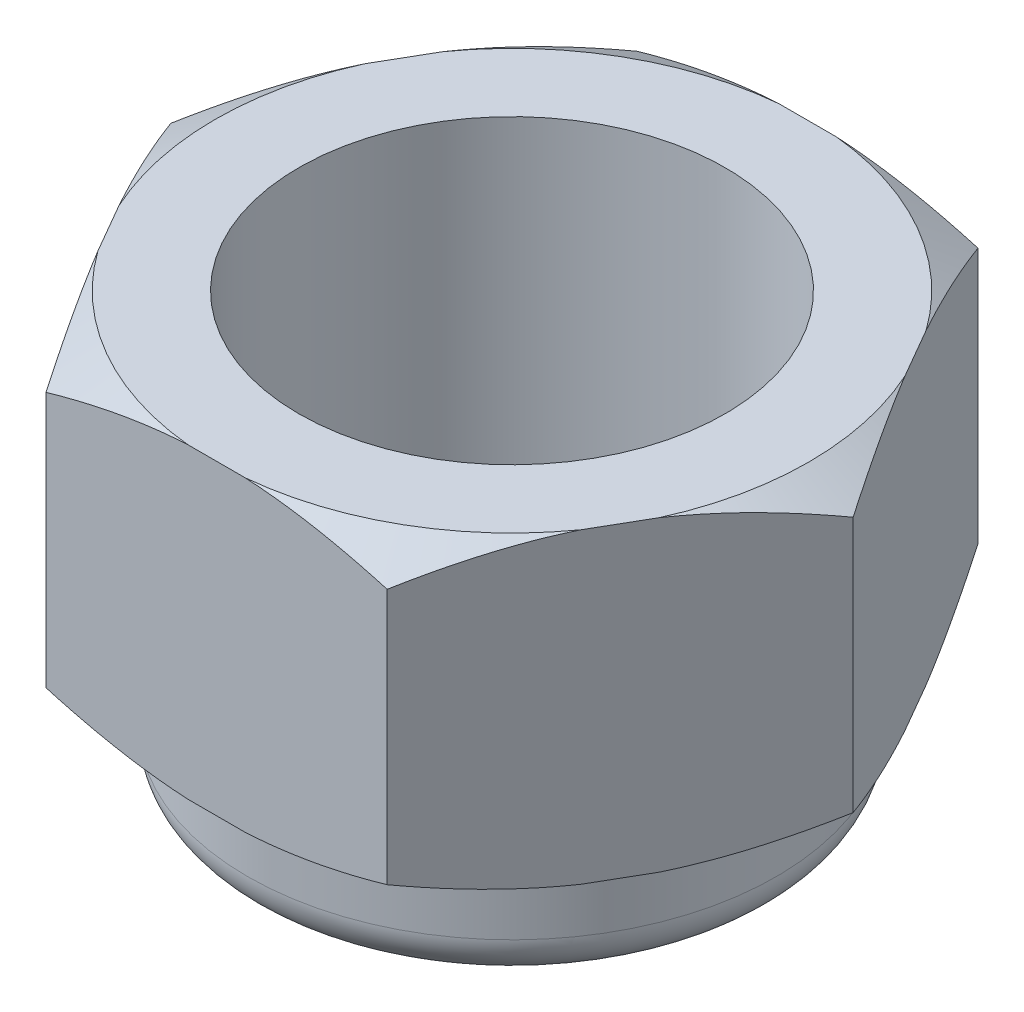
from build123d import *

# Parameters (mm, degrees)
SKETCH_1_R      = 2.5
EXTRUDE_1_DEPTH = 3.6
EXTRUDE_START   = -4.9
SKETCH_2_R      = 3.1
SKETCH_2_R_2    = 2.5
EXTRUDE_2_DEPTH = 4.9
FILLET_1_R      = 0.5


with BuildPart() as part:
    # 草图1 → 凸台-拉伸1 (new body)
    with BuildSketch(Plane(origin=(0, 0, 0), x_dir=(1, 0, 0), z_dir=(0, 1, 0))):
        Polygon((4, 0), (2, 3.464101615), (-2, 3.464101615), (-4, 0), (-2, -3.464101615), (2, -3.464101615), align=None)
        with Locations(Location((0, 0, 0), (0, 0, 270))):
            Circle(SKETCH_1_R, mode=Mode.SUBTRACT)
    extrude(amount=EXTRUDE_1_DEPTH)

    # 草图4 → 切除-旋转1 (revolve, cut)
    with BuildSketch(Plane(origin=(0, 0, 0), x_dir=(-0.49999999999999806, 0, 0.8660254037844398), z_dir=(-0.8660254037844397, 0, -0.499999999999998))):
        Polygon((0, 5.609401077), (-4, 3.3), (-4, 5.663718026), (-4, 6.109401077), (0, 6.109401077), align=None)
        Polygon((0, -2.509401077), (0, -2.009401077), (-4, 0.3), (-4, -2.063718026), (-4, -2.509401077), align=None)
    revolve(axis=Axis((0, 6.109401077, 0), (0, 1, 0)), mode=Mode.SUBTRACT)

    # 草图2 → 凸台-拉伸2 (add)
    with BuildSketch(Plane(origin=(0, 3.6, 0), x_dir=(1, 0, 0), z_dir=(0, 1, 0)).offset(EXTRUDE_START)):
        with Locations(Location((0, 0, 0), (0, 0, 270))):
            Circle(SKETCH_2_R)
        with Locations(Location((0, 0, 0), (0, 0, 270))):
            Circle(SKETCH_2_R_2, mode=Mode.SUBTRACT)
    extrude(amount=EXTRUDE_2_DEPTH)

    # 圆角1
    fillet_1_edges = [part.edges().sort_by_distance(p)[0] for p in [
        (0, -1.3, -3.1),
    ]]
    fillet(fillet_1_edges, radius=FILLET_1_R)


solid = part.part
